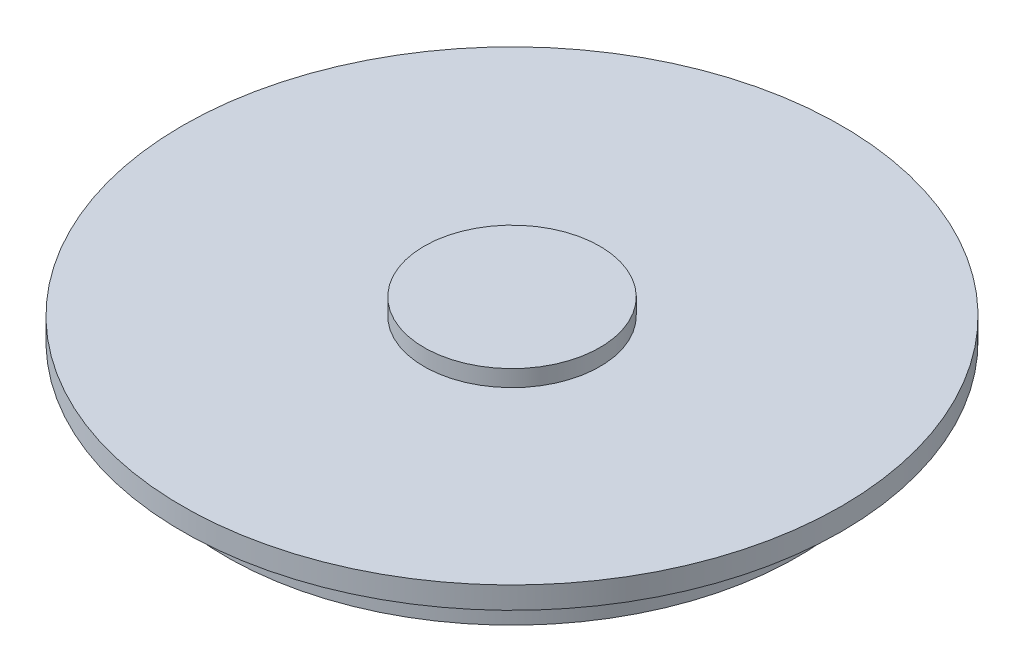
from build123d import *


with BuildPart() as part:
    # Sketch1 → Lid Revolve (revolve)
    with BuildSketch(Plane.XY, mode=Mode.PRIVATE) as lid_revolve_sk:
        Polygon((0, 0), (48, 0), (48, -8), (52, -8), (52, 0), (60, 0), (60, 4), (16, 4), (16, 7), (0, 7), align=None)
    revolve(lid_revolve_sk.sketch.rotate(Axis((0, 7, 0), (0, -1, 0)), 180), axis=Axis((0, 7, 0), (0, -1, 0)))


solid = part.part
